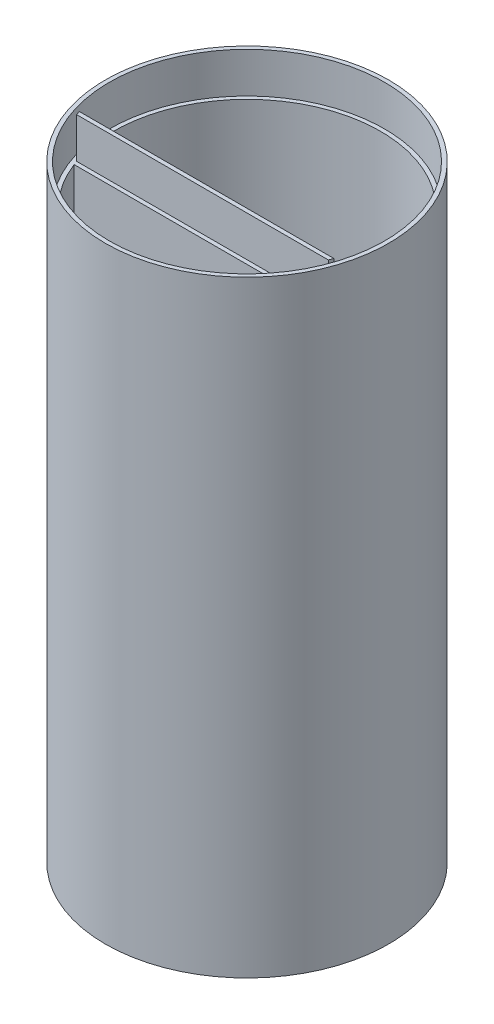
from build123d import *

# Parameters (mm, degrees)
SKETCH1_R           = 35
BOSS_EXTRUDE1_DEPTH = 150
CUT_EXTRUDE1_START  = -10
SKETCH3_R           = 34
CUT_EXTRUDE1_DEPTH  = 10


with BuildPart() as part:
    # Sketch1 → Boss-Extrude1 (new body)
    with BuildSketch(Plane(origin=(0, 0, 0), x_dir=(1, 0, 0), z_dir=(0, 1, 0))):
        with Locations(Location((0, 0, 0), (0, 0, 270))):
            Circle(SKETCH1_R)
        with BuildLine():
            Line((-31.448370387, -10), (31.448370387, -10))
            ThreePointArc((31.448370387, -10), (0, 33), (-31.448370387, -10))
        make_face(mode=Mode.SUBTRACT)
        with BuildLine():
            Line((-30.740852298, -12), (30.740852298, -12))
            ThreePointArc((30.740852298, -12), (0, -33), (-30.740852298, -12))
        make_face(mode=Mode.SUBTRACT)
    extrude(amount=BOSS_EXTRUDE1_DEPTH)

    # Sketch3 → Cut-Extrude1 (cut)
    with BuildSketch(Plane(origin=(0, 150, 0), x_dir=(1, 0, 0), z_dir=(0, 1, 0)).offset(CUT_EXTRUDE1_START)):
        with Locations(Location((0, 0, 0), (0, 0, 270))):
            Circle(SKETCH3_R)
        with BuildLine():
            Line((31.112698372, -11), (-31.112698372, -11))
            ThreePointArc((-31.112698372, -11), (0, 33), (31.112698372, -11))
        make_face(mode=Mode.SUBTRACT)
        with BuildLine():
            Line((-30.740852298, -12), (30.740852298, -12))
            ThreePointArc((30.740852298, -12), (0, -33), (-30.740852298, -12))
        make_face(mode=Mode.SUBTRACT)
    extrude(amount=CUT_EXTRUDE1_DEPTH, mode=Mode.SUBTRACT)


solid = part.part
